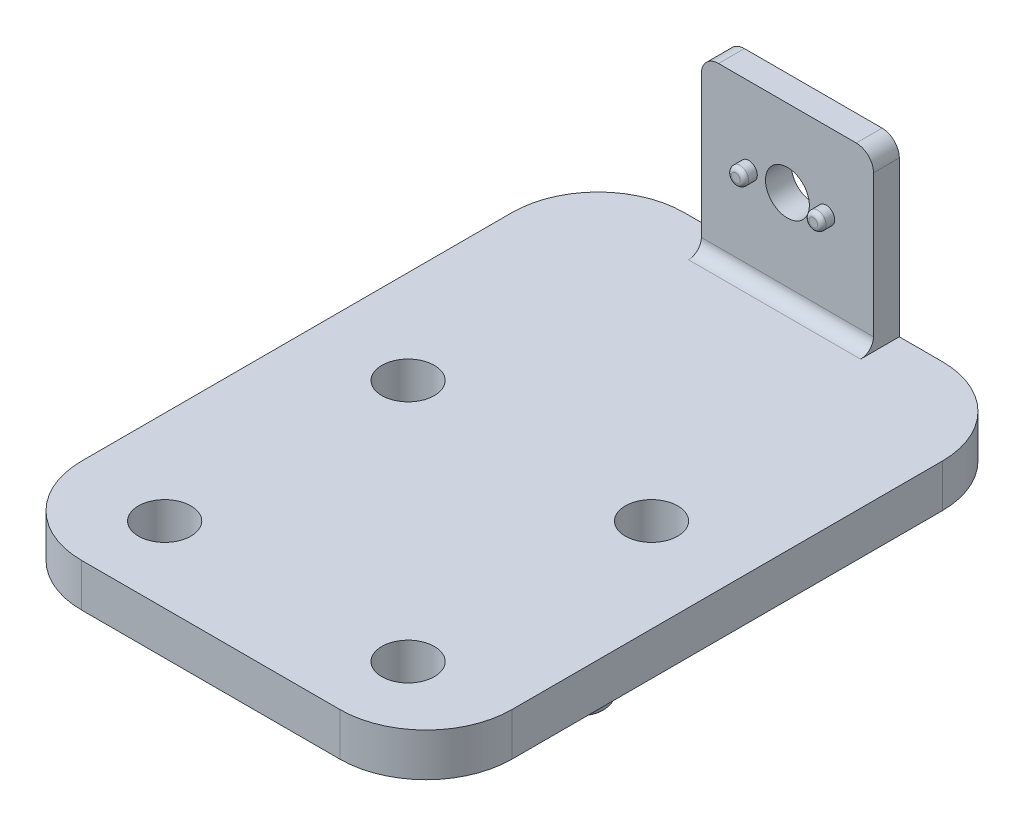
from build123d import *

# Parameters (mm, degrees)
SKETCH_1_W          = 50
SKETCH_1_H          = 70
EXTRUDE_1_DEPTH     = 5
SKETCH_2_R          = 3.05
CUT_EXTRUDE_1_DEPTH = 54.53308254
SKETCH_4_R          = 2.95
EXTRUDE_2_DEPTH     = 3
FILLET_1_R          = 1
FILLET_2_R          = 10
SKETCH_6_W          = 20
SKETCH_6_H          = 3
EXTRUDE_3_DEPTH     = 20
EXTRUDE_5_DEPTH     = 20
FILLET_3_R          = 2
SKETCH_9_R          = 2.55
CUT_EXTRUDE_2_DEPTH = 76.756187866
SKETCH_9_4_R        = 1
EXTRUDE_6_DEPTH     = 1.5
FILLET_4_R          = 0.5


with BuildPart() as part:
    # 草图1 → 凸台-拉伸1 (new body)
    with BuildSketch(Plane(origin=(0, 0, 0), x_dir=(1, 0, 0), z_dir=(0, 1, 0))):
        with Locations((0, 12.072188459)):
            Rectangle(SKETCH_1_W, SKETCH_1_H)
    extrude(amount=EXTRUDE_1_DEPTH)

    # 草图2 → 切除-拉伸1 (cut, through all)
    with BuildSketch(Plane(origin=(0, 5, 0), x_dir=(1, 0, 0), z_dir=(0, 1, 0))):
        with Locations((14.142135624, 14.142135624)):
            Circle(SKETCH_2_R)
        with Locations((14.142135624, -14.142135624)):
            Circle(SKETCH_2_R)
        with Locations((-14.142135624, -14.142135624)):
            Circle(SKETCH_2_R)
        with Locations((-14.142135624, 14.142135624)):
            Circle(SKETCH_2_R)
    extrude(amount=-CUT_EXTRUDE_1_DEPTH, mode=Mode.SUBTRACT)

    # 草图4 → 凸台-拉伸2 (add)
    with BuildSketch(Plane.XZ):
        with Locations((20, 0)):
            Circle(SKETCH_4_R)
        with Locations((-20, 0)):
            Circle(SKETCH_4_R)
    extrude(amount=EXTRUDE_2_DEPTH)

    # 圆角1
    fillet_1_edges = [part.edges().sort_by_distance(p)[0] for p in [
        (-22.95, -3, 0),
        (17.05, -3, 0),
    ]]
    fillet(fillet_1_edges, radius=FILLET_1_R)

    # 圆角2
    fillet_2_edges = [part.edges().sort_by_distance(p)[0] for p in [
        (-25, 2.5, -47.072188459),
        (25, 2.5, -47.072188459),
        (-25, 2.5, 22.927811541),
        (25, 2.5, 22.927811541),
    ]]
    fillet(fillet_2_edges, radius=FILLET_2_R)

    # 草图6 → 凸台-拉伸3 (add)
    with BuildSketch(Plane(origin=(0, 5, 0), x_dir=(1, 0, 0), z_dir=(0, 1, 0))):
        with Locations((0, 45.572188459)):
            Rectangle(SKETCH_6_W, SKETCH_6_H)
    extrude(amount=EXTRUDE_3_DEPTH)

    # 草图8 → 凸台-拉伸5 (add)
    with BuildSketch(Plane.ZY.offset(10)):
        with BuildLine():
            Line((-44.072188459, 6.5), (-44.072188459, 5))
            Line((-44.072188459, 5), (-42.572188459, 5))
            ThreePointArc((-42.572188459, 5), (-43.63284863, 5.439339828), (-44.072188459, 6.5))
        make_face()
    extrude(amount=-EXTRUDE_5_DEPTH)

    # 圆角3
    fillet_3_edges = [part.edges().sort_by_distance(p)[0] for p in [
        (-10, 25, -45.572188459),
        (10, 25, -45.572188459),
    ]]
    fillet(fillet_3_edges, radius=FILLET_3_R)

    # 草图9 → 切除-拉伸2 (cut, through all)
    with BuildSketch(Plane.XY.offset(-44.072188459)):
        with Locations((0, 16)):
            Circle(SKETCH_9_R)
    extrude(amount=-CUT_EXTRUDE_2_DEPTH, mode=Mode.SUBTRACT)

    # 草图9<4> → 凸台-拉伸6 (add)
    with BuildSketch(Plane.XY.offset(-44.072188459)):
        with Locations((-4.5, 16)):
            Circle(SKETCH_9_4_R)
        with Locations((4.5, 16)):
            Circle(SKETCH_9_4_R)
    extrude(amount=EXTRUDE_6_DEPTH)

    # 圆角4
    fillet_4_edges = [part.edges().sort_by_distance(p)[0] for p in [
        (3.5, 16, -42.572188459),
        (-5.5, 16, -42.572188459),
    ]]
    fillet(fillet_4_edges, radius=FILLET_4_R)


solid = part.part
